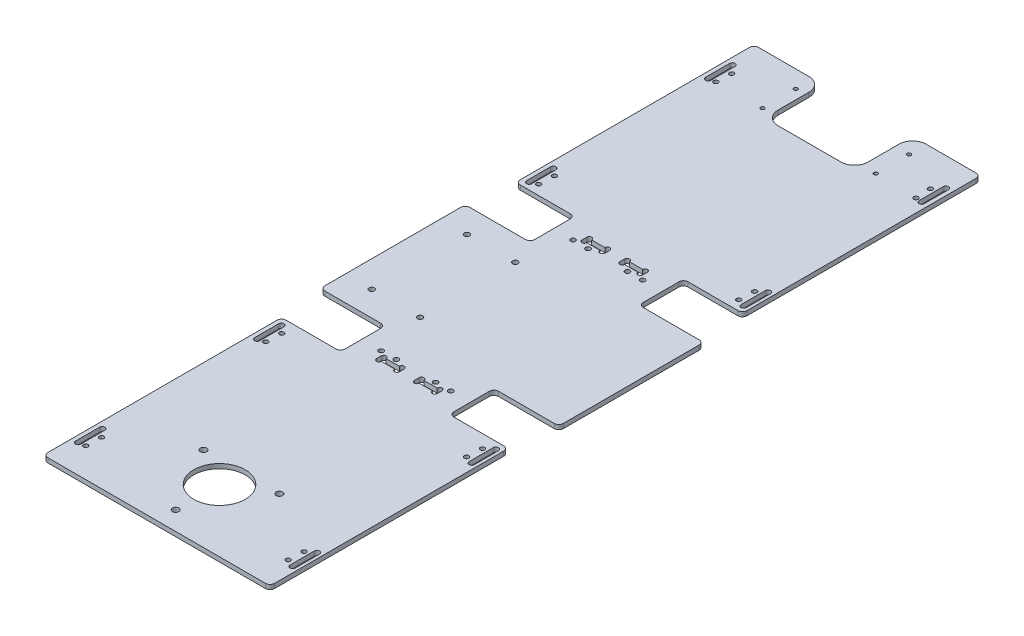
from build123d import *

# Parameters (mm, degrees)
SKETCH_1_R           = 1.6
EXTRUDE_1_DEPTH      = 3
FILLET_1_R           = 3
CUT_EXTRUDE_3_DEPTH  = 262.299675597
CUT_EXTRUDE_4_DEPTH  = 262.299675597
CUT_EXTRUDE_5_DEPTH  = 262.299675597
SKETCH_5_R           = 1.5
CUT_EXTRUDE_6_DEPTH  = 262.299675597
SKETCH_7_R           = 1.5
CUT_EXTRUDE_7_DEPTH  = 262.299675597
CUT_EXTRUDE_8_DEPTH  = 10
SKETCH_10_W          = 59.555936513
SKETCH_10_H          = 38.408749974
CUT_EXTRUDE_9_DEPTH  = 10
CUT_EXTRUDE_10_DEPTH = 10
FILLET_2_R           = 9
SKETCH_13_R          = 1.75
CUT_EXTRUDE_11_DEPTH = 10


with BuildPart() as part:
    # 草图1 → 凸台-拉伸1 (new body)
    with BuildSketch(Plane(origin=(0, 0, 0), x_dir=(1, 0, 0), z_dir=(0, 1, 0))):
        Polygon((-1, -77.5), (-40, -77.5), (-40, -235.15), (110, -235.15), (110, -77.5), (71, -77.5), (71, -47.937176289), (113.89906921, -47.937176289), (113.89906921, 47.937176289), (71, 47.937176289), (71, 77.5), (110, 77.5), (110, 235.15), (-40, 235.15), (-40, 77.5), (-1, 77.5), (-1, 47.937176289), (-43.89906921, 47.937176289), (-43.89906921, -47.937176289), (-1, -47.937176289), align=None)
        with Locations((48.025, -63.59)):
            Circle(SKETCH_1_R, mode=Mode.SUBTRACT)
        with Locations((58.025, -63.59)):
            Circle(SKETCH_1_R, mode=Mode.SUBTRACT)
        with Locations((58.025, 63.41)):
            Circle(SKETCH_1_R, mode=Mode.SUBTRACT)
        with Locations((48.025, 63.41)):
            Circle(SKETCH_1_R, mode=Mode.SUBTRACT)
        with Locations((11.975, -63.59)):
            Circle(SKETCH_1_R, mode=Mode.SUBTRACT)
        with Locations((21.975, -63.59)):
            Circle(SKETCH_1_R, mode=Mode.SUBTRACT)
        with Locations((21.975, 63.41)):
            Circle(SKETCH_1_R, mode=Mode.SUBTRACT)
        with Locations((11.975, 63.41)):
            Circle(SKETCH_1_R, mode=Mode.SUBTRACT)
        with BuildLine():
            Line((30.075, -69.59), (30.075, -66.41))
            ThreePointArc((30.075, -66.41), (28.475, -64.81), (26.875, -66.41))
            Line((26.875, -66.41), (18.125, -66.41))
            ThreePointArc((18.125, -66.41), (16.525, -64.81), (14.925, -66.41))
            Line((14.925, -66.41), (14.925, -69.59))
            ThreePointArc((14.925, -69.59), (16.525, -71.19), (18.125, -69.59))
            Line((18.125, -69.59), (26.875, -69.59))
            ThreePointArc((26.875, -69.59), (28.475, -71.19), (30.075, -69.59))
        make_face(mode=Mode.SUBTRACT)
        with BuildLine():
            Line((43.125, 69.59), (51.875, 69.59))
            ThreePointArc((51.875, 69.59), (53.475, 71.19), (55.075, 69.59))
            Line((55.075, 69.59), (55.075, 66.41))
            ThreePointArc((55.075, 66.41), (53.475, 64.81), (51.875, 66.41))
            Line((51.875, 66.41), (43.125, 66.41))
            ThreePointArc((43.125, 66.41), (41.525, 64.81), (39.925, 66.41))
            Line((39.925, 66.41), (39.925, 69.59))
            ThreePointArc((39.925, 69.59), (41.525, 71.19), (43.125, 69.59))
        make_face(mode=Mode.SUBTRACT)
        with BuildLine():
            Line((55.075, -69.59), (55.075, -66.41))
            ThreePointArc((55.075, -66.41), (53.475, -64.81), (51.875, -66.41))
            Line((51.875, -66.41), (43.125, -66.41))
            ThreePointArc((43.125, -66.41), (41.525, -64.81), (39.925, -66.41))
            Line((39.925, -66.41), (39.925, -69.59))
            ThreePointArc((39.925, -69.59), (41.525, -71.19), (43.125, -69.59))
            Line((43.125, -69.59), (51.875, -69.59))
            ThreePointArc((51.875, -69.59), (53.475, -71.19), (55.075, -69.59))
        make_face(mode=Mode.SUBTRACT)
        with BuildLine():
            Line((14.925, 69.59), (14.925, 66.41))
            ThreePointArc((14.925, 66.41), (16.525, 64.81), (18.125, 66.41))
            Line((18.125, 66.41), (26.875, 66.41))
            ThreePointArc((26.875, 66.41), (28.475, 64.81), (30.075, 66.41))
            Line((30.075, 66.41), (30.075, 69.59))
            ThreePointArc((30.075, 69.59), (28.475, 71.19), (26.875, 69.59))
            Line((26.875, 69.59), (18.125, 69.59))
            ThreePointArc((18.125, 69.59), (16.525, 71.19), (14.925, 69.59))
        make_face(mode=Mode.SUBTRACT)
    extrude(amount=EXTRUDE_1_DEPTH)

    # 圆角1
    fillet_1_edges = [part.edges().sort_by_distance(p)[0] for p in [
        (-40, 1.5, -235.15),
        (110, 1.5, -235.15),
        (113.89906921, 1.5, -47.937176289),
        (110, 1.5, -77.5),
        (71, 1.5, -77.5),
        (71, 1.5, -47.937176289),
        (-40, 1.5, -77.5),
        (-1, 1.5, -77.5),
        (-1, 1.5, -47.937176289),
        (-43.89906921, 1.5, -47.937176289),
        (-43.89906921, 1.5, 47.937176289),
        (-1, 1.5, 47.937176289),
        (113.89906921, 1.5, 47.937176289),
        (71, 1.5, 47.937176289),
        (-40, 1.5, 77.5),
        (-1, 1.5, 77.5),
        (71, 1.5, 77.5),
        (110, 1.5, 77.5),
        (110, 1.5, 235.15),
        (-40, 1.5, 235.15),
    ]]
    fillet(fillet_1_edges, radius=FILLET_1_R)

    # 草图3<4> → 切除-拉伸3 (cut, through all)
    with BuildSketch(Plane(origin=(0, 3, 0), x_dir=(1, 0, 0), z_dir=(0, 1, 0))):
        with BuildLine():
            Line((-33.899185667, 216.474287265), (-33.899185667, 200.474287265))
            ThreePointArc((-33.899185667, 200.474287265), (-35.65, 198.723472932), (-37.400814333, 200.474287265))
            Line((-37.400814333, 200.474287265), (-37.400814333, 216.474287265))
            ThreePointArc((-37.400814333, 216.474287265), (-35.65, 218.225101598), (-33.899185667, 216.474287265))
        make_face()
    extrude(amount=-CUT_EXTRUDE_3_DEPTH, mode=Mode.SUBTRACT)

    # 草图3 → 切除-拉伸4 (cut, through all)
    with BuildSketch(Plane(origin=(0, 3, 0), x_dir=(1, 0, 0), z_dir=(0, 1, 0))):
        with BuildLine():
            Line((103.899185667, 216.474287265), (103.899185667, 200.474287265))
            ThreePointArc((103.899185667, 200.474287265), (105.65, 198.723472932), (107.400814333, 200.474287265))
            Line((107.400814333, 200.474287265), (107.400814333, 216.474287265))
            ThreePointArc((107.400814333, 216.474287265), (105.65, 218.225101598), (103.899185667, 216.474287265))
        make_face()
    extrude(amount=-CUT_EXTRUDE_4_DEPTH, mode=Mode.SUBTRACT)

    # 草图4 → 切除-拉伸5 (cut, through all)
    with BuildSketch(Plane(origin=(0, 3, 0), x_dir=(1, 0, 0), z_dir=(0, 1, 0))):
        with BuildLine():
            Line((-33.9, 82), (-33.9, 98))
            ThreePointArc((-33.9, 98), (-35.65, 99.75), (-37.4, 98))
            Line((-37.4, 98), (-37.4, 82))
            ThreePointArc((-37.4, 82), (-35.65, 80.25), (-33.9, 82))
        make_face()
        with BuildLine():
            Line((108.1, 82), (108.1, 98))
            ThreePointArc((108.1, 98), (106.35, 99.75), (104.6, 98))
            Line((104.6, 98), (104.6, 82))
            ThreePointArc((104.6, 82), (106.35, 80.25), (108.1, 82))
        make_face()
        with BuildLine():
            Line((-33.9, -98), (-33.9, -82))
            ThreePointArc((-33.9, -82), (-35.65, -80.25), (-37.4, -82))
            Line((-37.4, -82), (-37.4, -98))
            ThreePointArc((-37.4, -98), (-35.65, -99.75), (-33.9, -98))
        make_face()
        with BuildLine():
            Line((108.1, -98), (108.1, -82))
            ThreePointArc((108.1, -82), (106.35, -80.25), (104.6, -82))
            Line((104.6, -82), (104.6, -98))
            ThreePointArc((104.6, -98), (106.35, -99.75), (108.1, -98))
        make_face()
        with BuildLine():
            Line((-33.9, -216.474287265), (-33.9, -200.474287265))
            ThreePointArc((-33.9, -200.474287265), (-35.65, -198.724287265), (-37.4, -200.474287265))
            Line((-37.4, -200.474287265), (-37.4, -216.474287265))
            ThreePointArc((-37.4, -216.474287265), (-35.65, -218.224287265), (-33.9, -216.474287265))
        make_face()
        with BuildLine():
            Line((108.1, -216.474287265), (108.1, -200.474287265))
            ThreePointArc((108.1, -200.474287265), (106.35, -198.724287265), (104.6, -200.474287265))
            Line((104.6, -200.474287265), (104.6, -216.474287265))
            ThreePointArc((104.6, -216.474287265), (106.35, -218.224287265), (108.1, -216.474287265))
        make_face()
    extrude(amount=-CUT_EXTRUDE_5_DEPTH, mode=Mode.SUBTRACT)

    # 草图5 → 切除-拉伸6 (cut, through all)
    with BuildSketch(Plane(origin=(0, 3, 0), x_dir=(1, 0, 0), z_dir=(0, 1, 0))):
        with Locations((-30.899185667, 211.226432822)):
            Circle(SKETCH_5_R)
        with Locations((-31.398561837, 201.238909433)):
            Circle(SKETCH_5_R)
        with Locations((100.899185667, 210.958696033)):
            Circle(SKETCH_5_R)
        with Locations((101.398561837, 200.971172644)):
            Circle(SKETCH_5_R)
        with Locations((101.6, 93.970523915)):
            Circle(SKETCH_5_R)
        with Locations((101.100623831, 83.983000526)):
            Circle(SKETCH_5_R)
        with Locations((-30.9, 93.970523915)):
            Circle(SKETCH_5_R)
        with Locations((-31.399376169, 83.983000526)):
            Circle(SKETCH_5_R)
        with Locations((-30.9, -86.568919479)):
            Circle(SKETCH_5_R)
        with Locations((-31.399376169, -96.556442868)):
            Circle(SKETCH_5_R)
        with Locations((101.6, -86.148217602)):
            Circle(SKETCH_5_R)
        with Locations((-30.9, -205.740220593)):
            Circle(SKETCH_5_R)
        with Locations((-31.399376169, -215.727743982)):
            Circle(SKETCH_5_R)
        with Locations((101.6, -204.249870867)):
            Circle(SKETCH_5_R)
        with Locations((101.100623831, -214.237394255)):
            Circle(SKETCH_5_R)
    extrude(amount=-CUT_EXTRUDE_6_DEPTH, mode=Mode.SUBTRACT)

    # 草图7 → 切除-拉伸7 (cut, through all)
    with BuildSketch(Plane(origin=(0, 3, 0), x_dir=(1, 0, 0), z_dir=(0, 1, 0))):
        with Locations((101.1, -96.148217602)):
            Circle(SKETCH_7_R)
    extrude(amount=-CUT_EXTRUDE_7_DEPTH, mode=Mode.SUBTRACT)

    # 草图9 → 切除-拉伸8 (cut)
    with BuildSketch(Plane(origin=(0, 3, 0), x_dir=(1, 0, 0), z_dir=(0, 1, 0))):
        with BuildLine():
            ThreePointArc((49.867648186, -202.204792748), (43.645216321, -178.982360883), (20.422784457, -185.204792748))
            ThreePointArc((20.422784457, -185.204792748), (26.645216321, -208.427224612), (49.867648186, -202.204792748))
        make_face()
        with BuildLine():
            ThreePointArc((8.211826264, -178.154792748), (8.980479612, -181.023446096), (11.849132959, -180.254792748))
            ThreePointArc((11.849132959, -180.254792748), (11.080479612, -177.3861394), (8.211826264, -178.154792748))
        make_face()
        with BuildLine():
            ThreePointArc((58.441299683, -178.154792748), (59.209953031, -181.023446096), (62.078606379, -180.254792748))
            ThreePointArc((62.078606379, -180.254792748), (61.309953031, -177.3861394), (58.441299683, -178.154792748))
        make_face()
        with BuildLine():
            ThreePointArc((33.326562973, -221.654792748), (34.095216321, -224.523446096), (36.963869669, -223.754792748))
            ThreePointArc((36.963869669, -223.754792748), (36.195216321, -220.8861394), (33.326562973, -221.654792748))
        make_face()
    extrude(amount=-CUT_EXTRUDE_8_DEPTH, mode=Mode.SUBTRACT)

    # 草图10 → 切除-拉伸9 (cut)
    with BuildSketch(Plane(origin=(0, 3, 0), x_dir=(1, 0, 0), z_dir=(0, 1, 0))):
        with Locations((35.124136097, 215.945625013)):
            Rectangle(SKETCH_10_W, SKETCH_10_H)
    extrude(amount=-CUT_EXTRUDE_9_DEPTH, mode=Mode.SUBTRACT)

    # 草图12 → 切除-拉伸10 (cut)
    with BuildSketch(Plane(origin=(0, 3, 0), x_dir=(1, 0, 0), z_dir=(0, 1, 0))):
        with BuildLine():
            ThreePointArc((-2.142029361, 201.650000181), (-0.892029361, 200.400000181), (0.357970639, 201.650000181))
            ThreePointArc((0.357970639, 201.650000181), (-0.892029361, 202.900000181), (-2.142029361, 201.650000181))
        make_face()
        with BuildLine():
            ThreePointArc((-2.142029361, 223.65), (-0.892029361, 222.4), (0.357970639, 223.65))
            ThreePointArc((0.357970639, 223.65), (-0.892029361, 224.9), (-2.142029361, 223.65))
        make_face()
        with BuildLine():
            ThreePointArc((72.857970636, 201.650000181), (74.107970636, 200.400000181), (75.357970636, 201.650000181))
            ThreePointArc((75.357970636, 201.650000181), (74.107970636, 202.900000181), (72.857970636, 201.650000181))
        make_face()
        with BuildLine():
            ThreePointArc((75.357970636, 223.65), (74.107970636, 224.9), (72.857970636, 223.65))
            ThreePointArc((72.857970636, 223.65), (74.107970636, 222.4), (75.357970636, 223.65))
        make_face()
    extrude(amount=-CUT_EXTRUDE_10_DEPTH, mode=Mode.SUBTRACT)

    # 圆角2
    fillet_2_edges = [part.edges().sort_by_distance(p)[0] for p in [
        (5.34616784, 1.5, -235.15),
        (5.34616784, 1.5, -196.741250026),
        (64.902104353, 1.5, -196.741250026),
        (64.902104353, 1.5, -235.15),
    ]]
    fillet(fillet_2_edges, radius=FILLET_2_R)

    # 草图13 → 切除-拉伸11 (cut)
    with BuildSketch(Plane.XZ):
        with Locations((-26.315012675, 31.5)):
            Circle(SKETCH_13_R)
        with Locations((5.684987325, 31.5)):
            Circle(SKETCH_13_R)
        with Locations((-26.315012675, -31.5)):
            Circle(SKETCH_13_R)
        with Locations((5.684987325, -31.5)):
            Circle(SKETCH_13_R)
    extrude(amount=-CUT_EXTRUDE_11_DEPTH, mode=Mode.SUBTRACT)


solid = part.part
